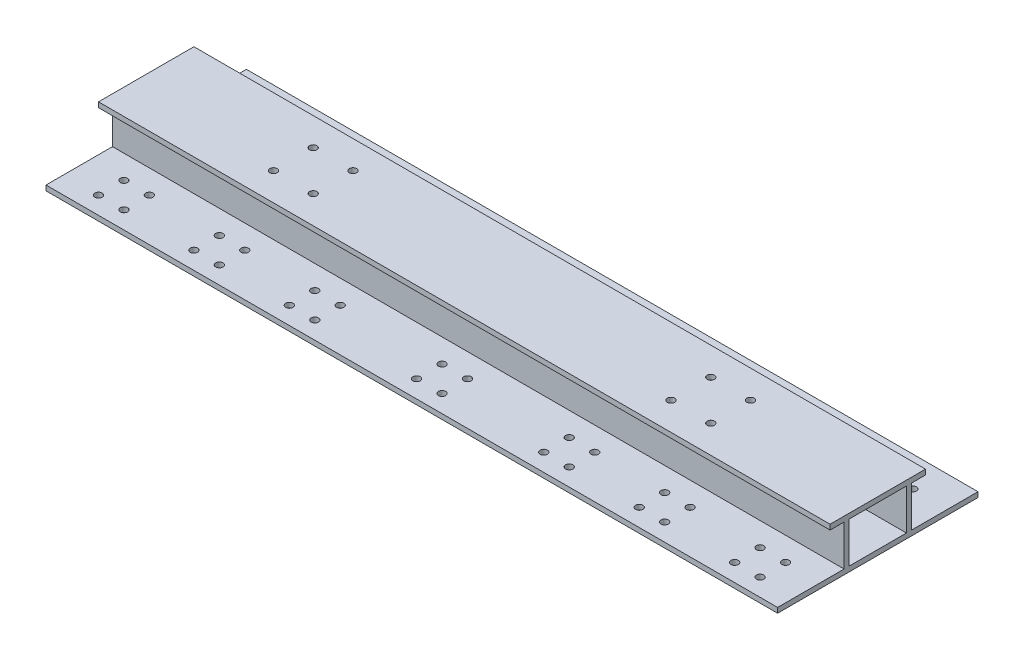
from build123d import *

# Parameters (mm, degrees)
SKETCH_7_W          = 180
SKETCH_7_H          = 128
EXTRUDE_1_DEPTH     = 2300
SKETCH_8_R          = 11.5
CUT_EXTRUDE_1_DEPTH = 16
SKETCH_9_R          = 11.5
CUT_EXTRUDE_2_DEPTH = 16


with BuildPart() as part:
    # 草图7 → 凸台-拉伸1 (new body)
    with BuildSketch(Plane(origin=(0, 0, 0), x_dir=(0, 0, -1), z_dir=(1, 0, 0))):
        Polygon((-315, 16), (-315, 0), (315, 0), (315, 16), (106, 16), (106, 144), (150, 144), (150, 160), (-150, 160), (-150, 144), (-106, 144), (-106, 16), align=None)
        with Locations((0, 80)):
            Rectangle(SKETCH_7_W, SKETCH_7_H, mode=Mode.SUBTRACT)
    extrude(amount=EXTRUDE_1_DEPTH)

    # 草图8 → 切除-拉伸1 (cut)
    with BuildSketch(Plane(origin=(0, 160, 0), x_dir=(1, 0, 0), z_dir=(0, 1, 0))):
        with Locations(Location((462.5, 62.5, 0), (0, 0, 270))):
            Circle(SKETCH_8_R)
        with Locations(Location((587.5, 62.5, 0), (0, 0, 270))):
            Circle(SKETCH_8_R)
        with Locations(Location((462.5, -62.5, 0), (0, 0, 270))):
            Circle(SKETCH_8_R)
        with Locations(Location((587.5, -62.5, 0), (0, 0, 270))):
            Circle(SKETCH_8_R)
        with Locations(Location((1712.5, 62.5, 0), (0, 0, 270))):
            Circle(SKETCH_8_R)
        with Locations(Location((1837.5, 62.5, 0), (0, 0, 270))):
            Circle(SKETCH_8_R)
        with Locations(Location((1712.5, -62.5, 0), (0, 0, 270))):
            Circle(SKETCH_8_R)
        with Locations(Location((1837.5, -62.5, 0), (0, 0, 270))):
            Circle(SKETCH_8_R)
    extrude(amount=-CUT_EXTRUDE_1_DEPTH, mode=Mode.SUBTRACT)

    # 草图9 → 切除-拉伸2 (cut)
    with BuildSketch(Plane.XZ):
        with Locations(Location((110, 260, 0), (0, 0, 270))):
            Circle(SKETCH_9_R)
        with Locations(Location((190, 260, 0), (0, 0, 270))):
            Circle(SKETCH_9_R)
        with Locations(Location((410, 260, 0), (0, 0, 270))):
            Circle(SKETCH_9_R)
        with Locations(Location((490, 260, 0), (0, 0, 270))):
            Circle(SKETCH_9_R)
        with Locations(Location((710, 260, 0), (0, 0, 270))):
            Circle(SKETCH_9_R)
        with Locations(Location((790, 260, 0), (0, 0, 270))):
            Circle(SKETCH_9_R)
        with Locations(Location((1110, 260, 0), (0, 0, 270))):
            Circle(SKETCH_9_R)
        with Locations(Location((1190, 260, 0), (0, 0, 270))):
            Circle(SKETCH_9_R)
        with Locations(Location((1510, 260, 0), (0, 0, 270))):
            Circle(SKETCH_9_R)
        with Locations(Location((1590, 260, 0), (0, 0, 270))):
            Circle(SKETCH_9_R)
        with Locations(Location((1810, 260, 0), (0, 0, 270))):
            Circle(SKETCH_9_R)
        with Locations(Location((1890, 260, 0), (0, 0, 270))):
            Circle(SKETCH_9_R)
        with Locations(Location((110, 180, 0), (0, 0, 270))):
            Circle(SKETCH_9_R)
        with Locations(Location((190, 180, 0), (0, 0, 270))):
            Circle(SKETCH_9_R)
        with Locations(Location((410, 180, 0), (0, 0, 270))):
            Circle(SKETCH_9_R)
        with Locations(Location((490, 180, 0), (0, 0, 270))):
            Circle(SKETCH_9_R)
        with Locations(Location((710, 180, 0), (0, 0, 270))):
            Circle(SKETCH_9_R)
        with Locations(Location((790, 180, 0), (0, 0, 270))):
            Circle(SKETCH_9_R)
        with Locations(Location((1110, 180, 0), (0, 0, 270))):
            Circle(SKETCH_9_R)
        with Locations(Location((1190, 180, 0), (0, 0, 270))):
            Circle(SKETCH_9_R)
        with Locations(Location((1510, 180, 0), (0, 0, 270))):
            Circle(SKETCH_9_R)
        with Locations(Location((1590, 180, 0), (0, 0, 270))):
            Circle(SKETCH_9_R)
        with Locations(Location((1810, 180, 0), (0, 0, 270))):
            Circle(SKETCH_9_R)
        with Locations(Location((1890, 180, 0), (0, 0, 270))):
            Circle(SKETCH_9_R)
        with Locations(Location((110, -140, 0), (0, 0, 270))):
            Circle(SKETCH_9_R)
        with Locations(Location((190, -140, 0), (0, 0, 270))):
            Circle(SKETCH_9_R)
        with Locations(Location((410, -140, 0), (0, 0, 270))):
            Circle(SKETCH_9_R)
        with Locations(Location((490, -140, 0), (0, 0, 270))):
            Circle(SKETCH_9_R)
        with Locations(Location((710, -140, 0), (0, 0, 270))):
            Circle(SKETCH_9_R)
        with Locations(Location((790, -140, 0), (0, 0, 270))):
            Circle(SKETCH_9_R)
        with Locations(Location((1110, -140, 0), (0, 0, 270))):
            Circle(SKETCH_9_R)
        with Locations(Location((1190, -140, 0), (0, 0, 270))):
            Circle(SKETCH_9_R)
        with Locations(Location((1510, -140, 0), (0, 0, 270))):
            Circle(SKETCH_9_R)
        with Locations(Location((1590, -140, 0), (0, 0, 270))):
            Circle(SKETCH_9_R)
        with Locations(Location((1810, -140, 0), (0, 0, 270))):
            Circle(SKETCH_9_R)
        with Locations(Location((1890, -140, 0), (0, 0, 270))):
            Circle(SKETCH_9_R)
        with Locations(Location((110, -220, 0), (0, 0, 270))):
            Circle(SKETCH_9_R)
        with Locations(Location((190, -220, 0), (0, 0, 270))):
            Circle(SKETCH_9_R)
        with Locations(Location((410, -220, 0), (0, 0, 270))):
            Circle(SKETCH_9_R)
        with Locations(Location((490, -220, 0), (0, 0, 270))):
            Circle(SKETCH_9_R)
        with Locations(Location((710, -220, 0), (0, 0, 270))):
            Circle(SKETCH_9_R)
        with Locations(Location((790, -220, 0), (0, 0, 270))):
            Circle(SKETCH_9_R)
        with Locations(Location((1110, -220, 0), (0, 0, 270))):
            Circle(SKETCH_9_R)
        with Locations(Location((1190, -220, 0), (0, 0, 270))):
            Circle(SKETCH_9_R)
        with Locations(Location((1510, -220, 0), (0, 0, 270))):
            Circle(SKETCH_9_R)
        with Locations(Location((1590, -220, 0), (0, 0, 270))):
            Circle(SKETCH_9_R)
        with Locations(Location((1810, -220, 0), (0, 0, 270))):
            Circle(SKETCH_9_R)
        with Locations(Location((1890, -220, 0), (0, 0, 270))):
            Circle(SKETCH_9_R)
        with Locations(Location((2110, 260, 0), (0, 0, 270))):
            Circle(SKETCH_9_R)
        with Locations(Location((2190, 260, 0), (0, 0, 270))):
            Circle(SKETCH_9_R)
        with Locations(Location((2110, 180, 0), (0, 0, 270))):
            Circle(SKETCH_9_R)
        with Locations(Location((2190, 180, 0), (0, 0, 270))):
            Circle(SKETCH_9_R)
        with Locations(Location((2110, -140, 0), (0, 0, 270))):
            Circle(SKETCH_9_R)
        with Locations(Location((2190, -140, 0), (0, 0, 270))):
            Circle(SKETCH_9_R)
        with Locations(Location((2110, -220, 0), (0, 0, 270))):
            Circle(SKETCH_9_R)
        with Locations(Location((2190, -220, 0), (0, 0, 270))):
            Circle(SKETCH_9_R)
    extrude(amount=-CUT_EXTRUDE_2_DEPTH, mode=Mode.SUBTRACT)


solid = part.part
